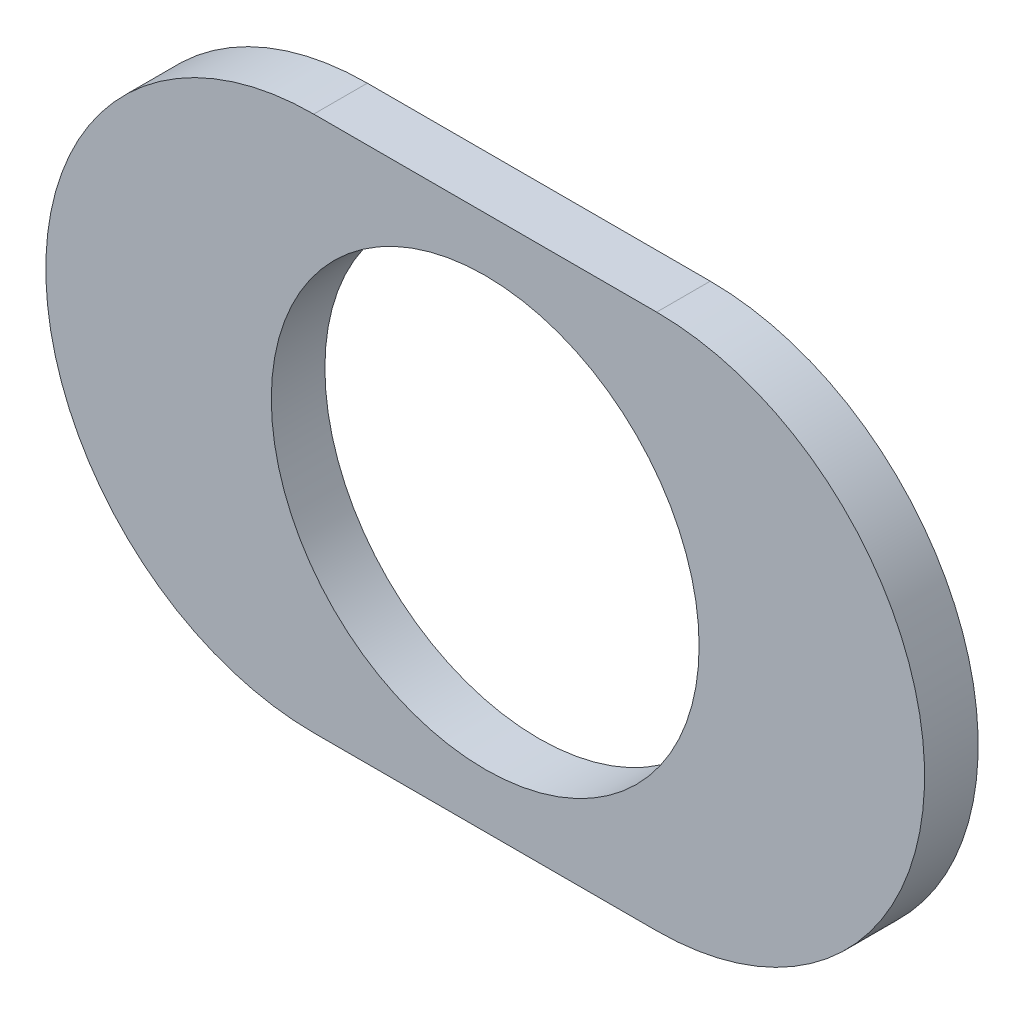
from build123d import *

# Parameters (mm, degrees)
SKETCH1_R           = 6.3373
BOSS_EXTRUDE1_DEPTH = 0.79375


with BuildPart() as part:
    # Sketch1 → Boss-Extrude1 (new, symmetric)
    with BuildSketch(Plane.XY):
        with BuildLine():
            Line((5.08, -7.9375), (-5.08, -7.9375))
            ThreePointArc((-5.08, -7.9375), (-13.0175, 0), (-5.08, 7.9375))
            Line((-5.08, 7.9375), (5.08, 7.9375))
            ThreePointArc((5.08, 7.9375), (13.0175, 0), (5.08, -7.9375))
        make_face()
        Circle(SKETCH1_R, mode=Mode.SUBTRACT)
    extrude(amount=BOSS_EXTRUDE1_DEPTH, both=True)


solid = part.part
